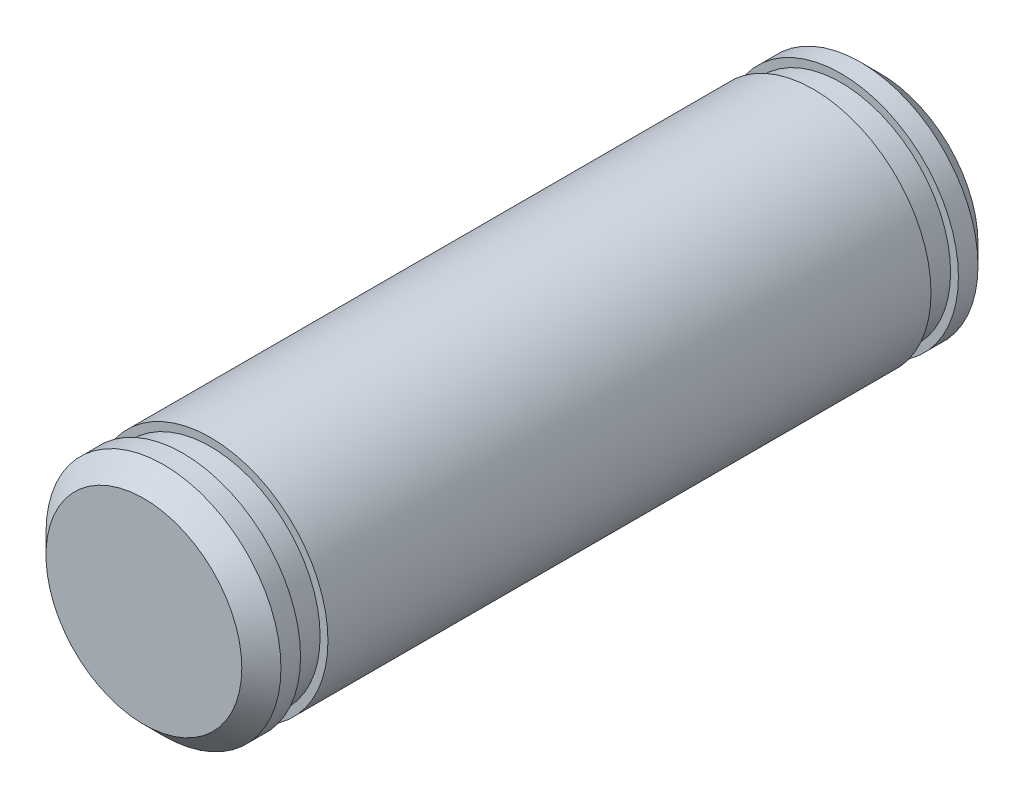
from build123d import *

# Parameters (mm, degrees)
SZKIC1_R                    = 3
DODANIE_WYCI_GNI_CIE1_DEPTH = 18.8
WYTNIJ_WYCI_GNI_CIE1_START  = -1.7
SZKIC2_R                    = 3
SZKIC2_R_2                  = 2.8
WYTNIJ_WYCI_GNI_CIE1_DEPTH  = 0.7
WYTNIJ_WYCI_GNI_CIE2_START  = -17.8
SZKIC2_2_R                  = 3
SZKIC2_2_R_2                = 2.8
WYTNIJ_WYCI_GNI_CIE2_DEPTH  = 0.7
SFAZOWANIE1_SIZE            = 0.5


with BuildPart() as part:
    # Szkic1 → Dodanie-wyciągnięcie1 (new body)
    with BuildSketch(Plane.XY):
        Circle(SZKIC1_R)
    extrude(amount=DODANIE_WYCI_GNI_CIE1_DEPTH)

    # Szkic2 → Wytnij-wyciągnięcie1 (cut)
    with BuildSketch(Plane.XY.offset(18.8).offset(WYTNIJ_WYCI_GNI_CIE1_START)):
        Circle(SZKIC2_R)
        Circle(SZKIC2_R_2, mode=Mode.SUBTRACT)
    extrude(amount=WYTNIJ_WYCI_GNI_CIE1_DEPTH, mode=Mode.SUBTRACT)

    # Szkic2<2> → Wytnij-wyciągnięcie2 (cut)
    with BuildSketch(Plane.XY.offset(18.8).offset(WYTNIJ_WYCI_GNI_CIE2_START)):
        Circle(SZKIC2_2_R)
        Circle(SZKIC2_2_R_2, mode=Mode.SUBTRACT)
    extrude(amount=WYTNIJ_WYCI_GNI_CIE2_DEPTH, mode=Mode.SUBTRACT)

    # Sfazowanie1
    sfazowanie1_edges = [part.edges().sort_by_distance(p)[0] for p in [
        (-3, 0, 0),
        (-3, 0, 18.8),
    ]]
    chamfer(sfazowanie1_edges, length=SFAZOWANIE1_SIZE)


solid = part.part
